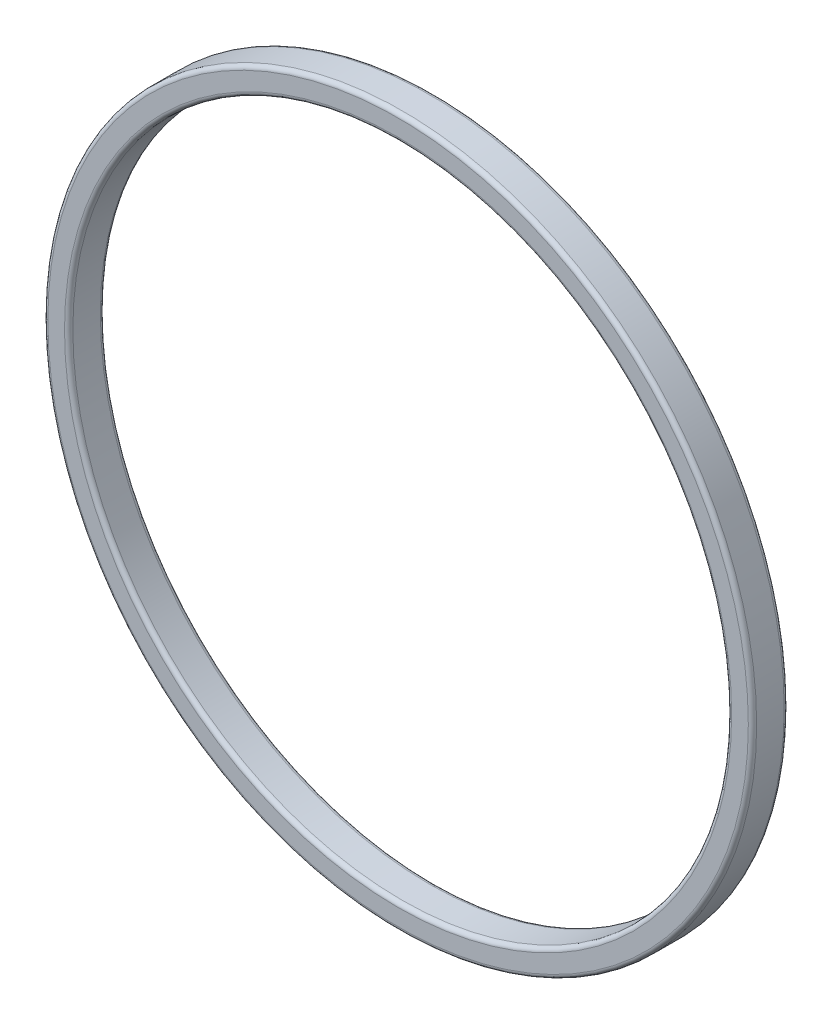
from build123d import *

# Parameters (mm, degrees)
SKETCH1_R           = 42.5
SKETCH1_R_2         = 39.5
BOSS_EXTRUDE1_DEPTH = 4.3
FILLET1_R           = 0.5


with BuildPart() as part:
    # Sketch1 → Boss-Extrude1 (new body)
    with BuildSketch(Plane.XY):
        with Locations(Location((0, 0, 0), (0, 0, 180))):
            Circle(SKETCH1_R)
        with Locations(Location((0, 0, 0), (0, 0, 180))):
            Circle(SKETCH1_R_2, mode=Mode.SUBTRACT)
    extrude(amount=BOSS_EXTRUDE1_DEPTH)

    # Fillet1
    fillet1_edges = [part.edges().sort_by_distance(p)[0] for p in [
        (42.5, 0, 0),
        (42.5, 0, 4.3),
        (39.5, 0, 0),
        (39.5, 0, 4.3),
    ]]
    fillet(fillet1_edges, radius=FILLET1_R)


solid = part.part
